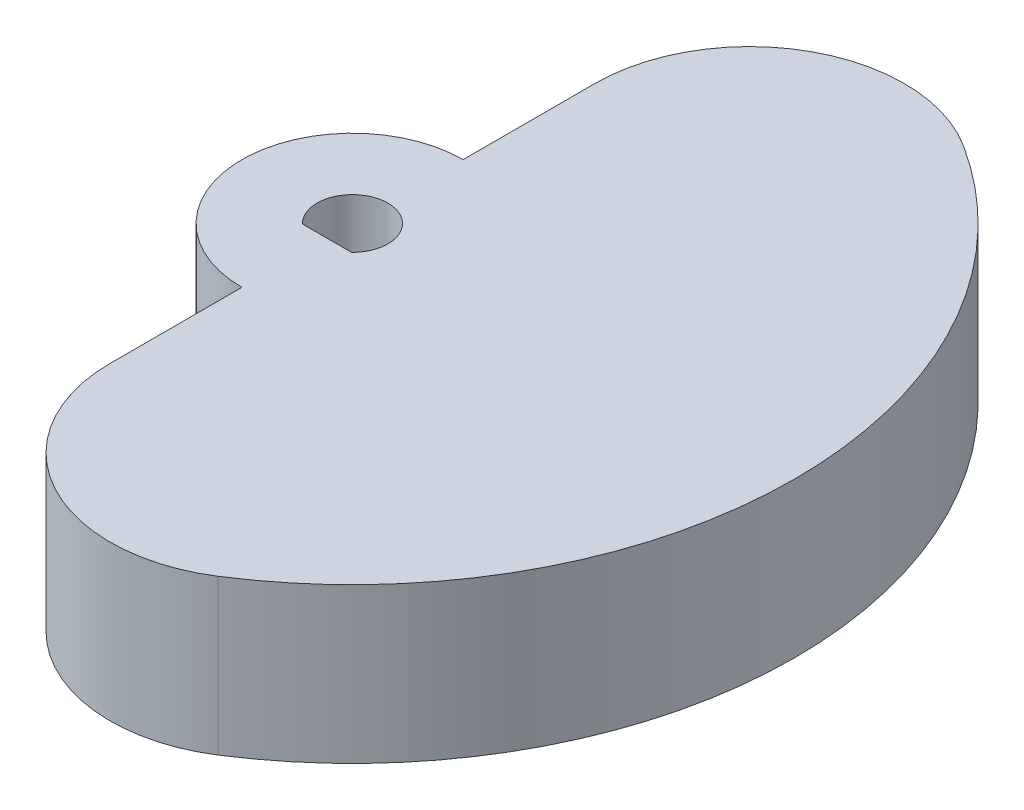
from build123d import *

# Parameters (mm, degrees)
BOSS_EXTRUDE1_DEPTH = 7
FILLET1_R           = 7


with BuildPart() as part:
    # Sketch1 → Boss-Extrude1 (new body)
    with BuildSketch(Plane(origin=(0, 0, 0), x_dir=(1, 0, 0), z_dir=(0, 1, 0))):
        with BuildLine():
            Line((0, 20), (0, 5))
            ThreePointArc((0, 5), (-5, 0), (0, -5))
            Line((0, -5), (0, -20))
            ThreePointArc((0, -20), (20, 0), (0, 20))
        make_face()
        with BuildLine():
            Line((1.112429773, -1.15), (-1.112429773, -1.15))
            ThreePointArc((-1.112429773, -1.15), (0, 1.6), (1.112429773, -1.15))
        make_face(mode=Mode.SUBTRACT)
    extrude(amount=BOSS_EXTRUDE1_DEPTH)

    # Fillet1
    fillet1_edges = [part.edges().sort_by_distance(p)[0] for p in [
        (0, 3.5, 20),
        (0, 3.5, -20),
    ]]
    fillet(fillet1_edges, radius=FILLET1_R)


solid = part.part
